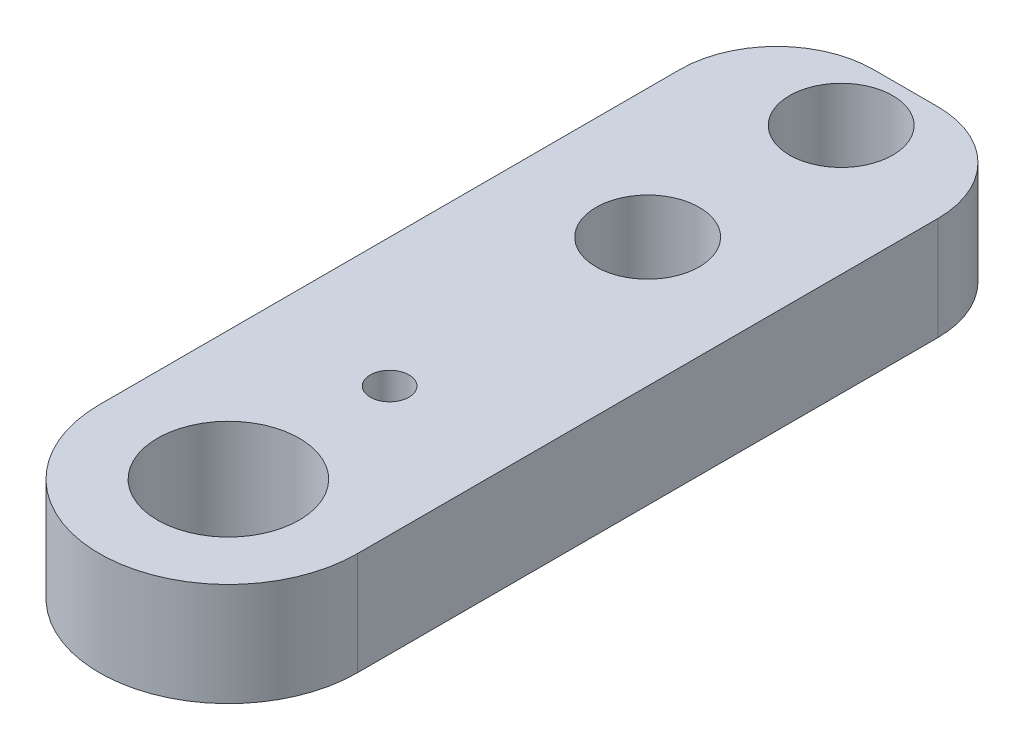
from build123d import *

# Parameters (mm, degrees)
SKETCH_1_R      = 1.6
SKETCH_1_R_2    = 2.2
SKETCH_1_R_3    = 0.6
EXTRUDE_1_DEPTH = 3.2


with BuildPart() as part:
    # 草图1 → 凸台-拉伸1 (new body)
    with BuildSketch(Plane(origin=(0, 0, 0), x_dir=(1, 0, 0), z_dir=(0, 1, 0))):
        with BuildLine():
            Line((-4, -9.086098517), (-4, 8.913901483))
            ThreePointArc((-4, 8.913901483), (-3.121320344, 11.035221826), (-1, 11.913901483))
            Line((-1, 11.913901483), (1, 11.913901483))
            ThreePointArc((1, 11.913901483), (3.121320344, 11.035221826), (4, 8.913901483))
            Line((4, 8.913901483), (4, -9.086098517))
            ThreePointArc((4, -9.086098517), (0, -13.086098517), (-4, -9.086098517))
        make_face()
        with Locations(Location((0, 9.913901483, 0), (0, 0, 270))):
            Circle(SKETCH_1_R, mode=Mode.SUBTRACT)
        with Locations(Location((0, -9.086098517, 0), (0, 0, 270))):
            Circle(SKETCH_1_R_2, mode=Mode.SUBTRACT)
        with Locations(Location((0, 3.913901483, 0), (0, 0, 270))):
            Circle(SKETCH_1_R, mode=Mode.SUBTRACT)
        with Locations(Location((0, -4.086098517, 0), (0, 0, 270))):
            Circle(SKETCH_1_R_3, mode=Mode.SUBTRACT)
    extrude(amount=EXTRUDE_1_DEPTH)


solid = part.part
